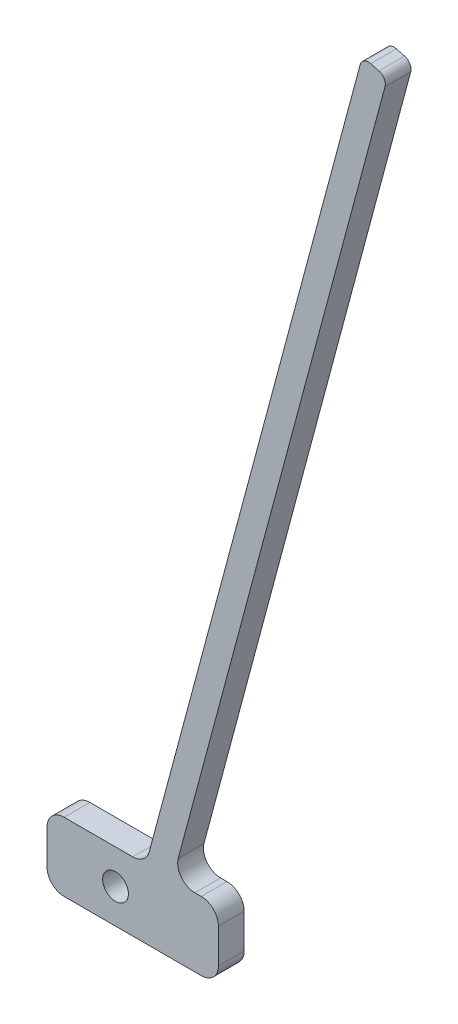
from build123d import *

# Parameters (mm, degrees)
SKETCH1_R           = 1.5
BOSS_EXTRUDE1_DEPTH = 3


with BuildPart() as part:
    # Sketch1 → Boss-Extrude1 (new body)
    with BuildSketch(Plane.XY):
        with BuildLine():
            Line((-11.534653976, -2), (-11.534653976, -6))
            ThreePointArc((-11.534653976, -6), (-10.948867538, -7.414213562), (-9.534653976, -8))
            Line((-9.534653976, -8), (6.465346024, -8))
            ThreePointArc((6.465346024, -8), (7.879559586, -7.414213562), (8.465346024, -6))
            Line((8.465346024, -6), (8.465346024, -2))
            ThreePointArc((8.465346024, -2), (7.879559586, -0.585786438), (6.465346024, 0))
            Line((6.465346024, 0), (5.712279287, 0))
            ThreePointArc((5.712279287, 0), (4.125572606, 0.782477142), (3.780427634, 2.51763809))
            Line((3.780427634, 2.51763809), (27.895854953, 92.51763809))
            ThreePointArc((27.895854953, 92.51763809), (27.795954531, 93.276457135), (27.188748172, 93.742382962))
            Line((27.188748172, 93.742382962), (26.222822346, 94.001202007))
            ThreePointArc((26.222822346, 94.001202007), (25.464003301, 93.901301584), (24.998077474, 93.294095226))
            Line((24.998077474, 93.294095226), (0.397197677, 1.48236191))
            ThreePointArc((0.397197677, 1.48236191), (-0.317131118, 0.413293319), (-1.534653976, 0))
            Line((-1.534653976, 0), (-9.534653976, 0))
            ThreePointArc((-9.534653976, 0), (-10.948867538, -0.585786438), (-11.534653976, -2))
        make_face()
        with Locations((-3.534653976, -4)):
            Circle(SKETCH1_R, mode=Mode.SUBTRACT)
    extrude(amount=BOSS_EXTRUDE1_DEPTH)


solid = part.part
